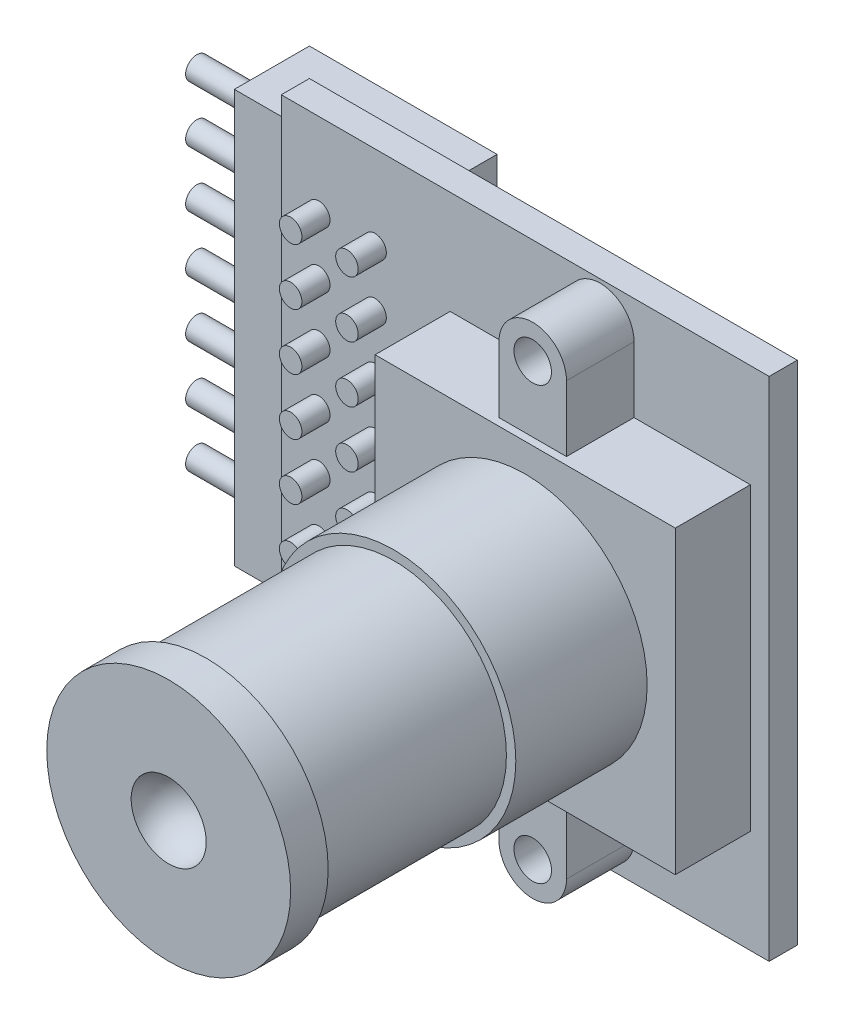
from build123d import *

# Parameters (mm, degrees)
SKETCH_1_W       = 16
SKETCH_1_H       = 16
EXTRUDE_1_DEPTH  = 4
SKETCH_2_R       = 6.5
EXTRUDE_2_DEPTH  = 7
SKETCH_3_R       = 6
EXTRUDE_3_DEPTH  = 12
EXTRUDE_START    = -2
SKETCH_4_R       = 6.5
EXTRUDE_4_DEPTH  = 2
SKETCH_6_R       = 1
EXTRUDE_5_DEPTH  = 3.6
SKETCH_7_W       = 26
SKETCH_7_H       = 27
EXTRUDE_6_DEPTH  = 1.5
SKETCH_8_W       = 10
SKETCH_8_H       = 22
EXTRUDE_7_DEPTH  = 4
SKETCH_9_R       = 0.6
EXTRUDE_8_DEPTH  = 4
SKETCH_10_R      = 0.6
EXTRUDE_9_DEPTH  = 1.5
SKETCH_11_W      = 4.148660329
SKETCH_11_H      = 3.0926377
EXTRUDE_10_DEPTH = 1.5


with BuildPart() as part:
    # 草图1 → 凸台-拉伸1 (new body)
    with BuildSketch(Plane.XY):
        Rectangle(SKETCH_1_W, SKETCH_1_H)
    extrude(amount=EXTRUDE_1_DEPTH)

    # 草图2 → 凸台-拉伸2 (add)
    with BuildSketch(Plane.XY.offset(4)):
        with Locations(Location((0, 0, 0), (0, 0, 180))):
            Circle(SKETCH_2_R)
    extrude(amount=EXTRUDE_2_DEPTH)

    # 草图3 → 凸台-拉伸3 (add)
    with BuildSketch(Plane.XY.offset(11)):
        Circle(SKETCH_3_R)
    extrude(amount=EXTRUDE_3_DEPTH)

    # 草图4 → 凸台-拉伸4 (add)
    with BuildSketch(Plane.XY.offset(23).offset(EXTRUDE_START)):
        with Locations(Location((0, 0, 0), (0, 0, 180))):
            Circle(SKETCH_4_R)
    extrude(amount=EXTRUDE_4_DEPTH)

    # 草图5 → 切除-旋转2 (revolve, cut)
    with BuildSketch(Plane.XY.offset(23)):
        with BuildLine():
            Line((0, 2), (0, -2))
            ThreePointArc((0, -2), (2, 0), (0, 2))
        make_face()
    revolve(axis=Axis((0, 2, 23), (0, -1, 0)), mode=Mode.SUBTRACT)

    # 草图6 → 凸台-拉伸5 (add)
    # profile 1 of 2: a face of its own
    with BuildSketch(Plane(origin=(0, 0, 0), x_dir=(-1, 0, 0), z_dir=(0, 0, -1))):
        with BuildLine():
            Line((-1.8, 8), (-1.8, 11.5))
            ThreePointArc((-1.8, 11.5), (0, 13.3), (1.8, 11.5))
            Line((1.8, 11.5), (1.8, 8))
            Line((1.8, 8), (-1.8, 8))
        make_face()
        with Locations((0, 11.5)):
            Circle(SKETCH_6_R, mode=Mode.SUBTRACT)
    # profile 2 of 2: a face of its own
    with BuildSketch(Plane(origin=(0, 0, 0), x_dir=(-1, 0, 0), z_dir=(0, 0, -1))):
        with BuildLine():
            Line((-1.8, -8), (1.8, -8))
            Line((1.8, -8), (1.8, -11.5))
            ThreePointArc((1.8, -11.5), (0, -13.3), (-1.8, -11.5))
            Line((-1.8, -11.5), (-1.8, -8))
        make_face()
        with Locations(Location((0, -11.5, 0), (0, 0, 180))):
            Circle(SKETCH_6_R, mode=Mode.SUBTRACT)
    extrude(amount=-EXTRUDE_5_DEPTH)

    # 草图7 → 凸台-拉伸6 (add)
    with BuildSketch(Plane(origin=(0, 0, 0), x_dir=(-1, 0, 0), z_dir=(0, 0, -1))):
        with Locations((4, 0)):
            Rectangle(SKETCH_7_W, SKETCH_7_H)
    extrude(amount=EXTRUDE_6_DEPTH)

    # 草图8 → 凸台-拉伸7 (add)
    with BuildSketch(Plane(origin=(0, 0, -1.5), x_dir=(-1, 0, 0), z_dir=(0, 0, -1))):
        with Locations((16, 0)):
            Rectangle(SKETCH_8_W, SKETCH_8_H)
    extrude(amount=EXTRUDE_7_DEPTH)

    # 草图9 → 凸台-拉伸8 (add)
    with BuildSketch(Plane.ZY.offset(21)):
        with Locations(Location((-3.5, 0, 0), (0, 0, 180))):
            Circle(SKETCH_9_R)
        with Locations(Location((-3.5, 3, 0), (0, 0, 180))):
            Circle(SKETCH_9_R)
        with Locations(Location((-3.5, 6, 0), (0, 0, 180))):
            Circle(SKETCH_9_R)
        with Locations(Location((-3.5, 9, 0), (0, 0, 180))):
            Circle(SKETCH_9_R)
        with Locations(Location((-3.5, -9, 0), (0, 0, 180))):
            Circle(SKETCH_9_R)
        with Locations(Location((-3.5, -6, 0), (0, 0, 180))):
            Circle(SKETCH_9_R)
        with Locations(Location((-3.5, -3, 0), (0, 0, 180))):
            Circle(SKETCH_9_R)
    extrude(amount=EXTRUDE_8_DEPTH)

    # 草图10 → 凸台-拉伸9 (add)
    with BuildSketch(Plane.XY):
        with Locations(Location((-12, 9, 0), (0, 0, 180))):
            Circle(SKETCH_10_R)
        with Locations(Location((-15, 9, 0), (0, 0, 180))):
            Circle(SKETCH_10_R)
        with Locations(Location((-15, 6, 0), (0, 0, 180))):
            Circle(SKETCH_10_R)
        with Locations(Location((-15, 3, 0), (0, 0, 180))):
            Circle(SKETCH_10_R)
        with Locations(Location((-15, 0, 0), (0, 0, 180))):
            Circle(SKETCH_10_R)
        with Locations(Location((-15, -3, 0), (0, 0, 180))):
            Circle(SKETCH_10_R)
        with Locations(Location((-15, -6, 0), (0, 0, 180))):
            Circle(SKETCH_10_R)
        with Locations(Location((-15, -9, 0), (0, 0, 180))):
            Circle(SKETCH_10_R)
        with Locations(Location((-12, 6, 0), (0, 0, 180))):
            Circle(SKETCH_10_R)
        with Locations(Location((-12, 3, 0), (0, 0, 180))):
            Circle(SKETCH_10_R)
        with Locations(Location((-12, 0, 0), (0, 0, 180))):
            Circle(SKETCH_10_R)
        with Locations(Location((-12, -3, 0), (0, 0, 180))):
            Circle(SKETCH_10_R)
        with Locations(Location((-12, -6, 0), (0, 0, 180))):
            Circle(SKETCH_10_R)
        with Locations(Location((-12, -9, 0), (0, 0, 180))):
            Circle(SKETCH_10_R)
    extrude(amount=EXTRUDE_9_DEPTH)

    # 草图11 → 凸台-拉伸10 (add)
    with BuildSketch(Plane.XY):
        with Locations((-6.793116996, -10.371650821)):
            Rectangle(SKETCH_11_W, SKETCH_11_H)
    extrude(amount=EXTRUDE_10_DEPTH)


solid = part.part
